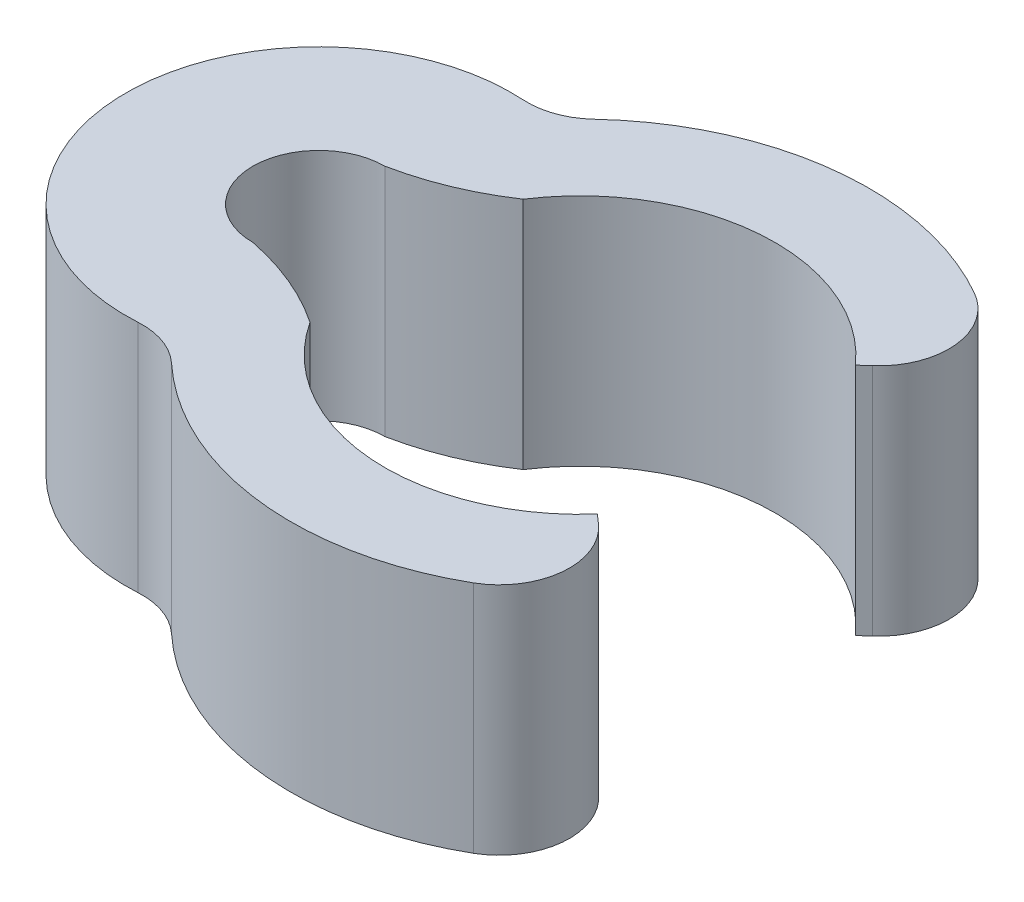
from build123d import *

# Parameters (mm, degrees)
BOSS_EXTRUDE3_DEPTH = 10
FILLET3_R           = 3


with BuildPart() as part:
    # Sketch1 → Boss-Extrude3 (new body)
    with BuildSketch(Plane(origin=(0, 0, 0), x_dir=(1, 0, 0), z_dir=(0, 1, 0))):
        with BuildLine():
            Line((-59.825295148, 15.68233951), (-56.816678559, 18.33423136))
            ThreePointArc((-56.816678559, 18.33423136), (-66.151990039, 22.514585376), (-75.433985922, 18.217149798))
            ThreePointArc((-75.433985922, 18.217149798), (-85.46391923, 10.174191538), (-75.433985922, 2.131233278))
            ThreePointArc((-75.433985922, 2.131233278), (-66.151990039, -2.1662023), (-56.816678559, 2.014151715))
            Line((-56.816678559, 2.014151715), (-59.825295148, 4.666043566))
            ThreePointArc((-59.825295148, 4.666043566), (-66.67551375, 1.865796025), (-73.051288265, 5.622973224))
            ThreePointArc((-73.051288265, 5.622973224), (-75.052192589, 6.694861395), (-77.224146609, 7.3545417))
            ThreePointArc((-77.224146609, 7.3545417), (-80.043796447, 10.174191538), (-77.224146609, 12.993841376))
            ThreePointArc((-77.224146609, 12.993841376), (-75.052192589, 13.653521681), (-73.051288265, 14.725409851))
            ThreePointArc((-73.051288265, 14.725409851), (-66.67551375, 18.48258705), (-59.825295148, 15.68233951))
        make_face()
    extrude(amount=BOSS_EXTRUDE3_DEPTH)

    # Fillet3
    fillet3_edges = [part.edges().sort_by_distance(p)[0] for p in [
        (-56.816678559, 5, -2.014151715),
        (-75.433985922, 5, -2.131233278),
        (-75.433985922, 5, -18.217149798),
        (-56.816678559, 5, -18.33423136),
    ]]
    fillet(fillet3_edges, radius=FILLET3_R)


solid = part.part
